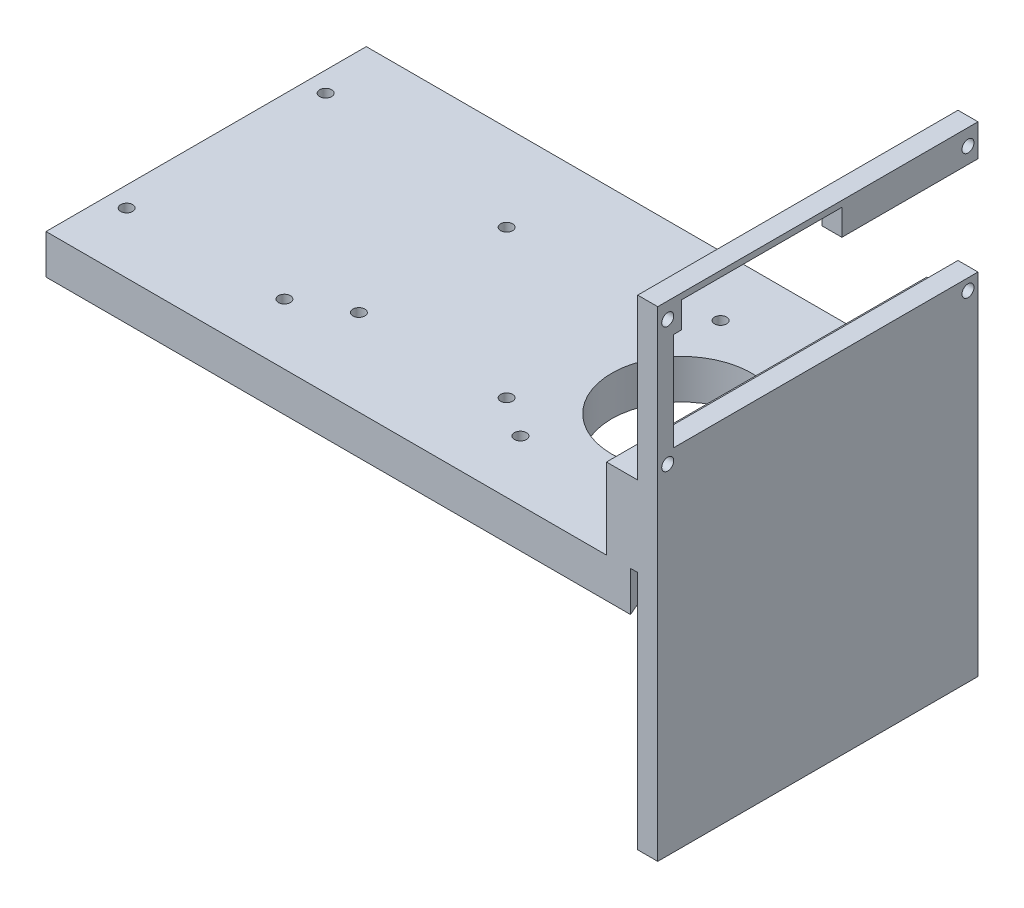
from build123d import *

# Parameters (mm, degrees)
BOSS_EXTRUDE1_DEPTH   = 80
CORTE_EXTRUS_O1_DEPTH = 10
SKETCH3_W             = 5
SKETCH3_H             = 80
BOSS_EXTRUDE2_DEPTH   = 50
SKETCH4_W             = 80
SKETCH4_H             = 9.86245083
BOSS_EXTRUDE3_DEPTH   = 140
SKETCH5_R             = 1.5
SKETCH5_R_2           = 17.5
CUT_EXTRUDE1_DEPTH    = 40
SKETCH6_W             = 5
SKETCH6_H             = 80
BOSS_EXTRUDE4_DEPTH   = 40
SKETCH7_R             = 1.5
CUT_EXTRUDE2_DEPTH    = 40


with BuildPart() as part:
    # Sketch1 → Boss-Extrude1 (new body)
    with BuildSketch(Plane.XY):
        Polygon((0, 0), (0, 30), (12.8, 30), (12.8, 0), (7.8, 0), (7.8, 10), (6, 10), (6, 0), align=None)
    extrude(amount=BOSS_EXTRUDE1_DEPTH)

    # Esboço2 → Corte-extrusão1 (cut)
    with BuildSketch(Plane.XZ):
        with BuildLine():
            Line((6, 80), (6, 0))
            ThreePointArc((6, 0), (-2.670710227, 40), (6, 80))
        make_face()
    extrude(amount=-CORTE_EXTRUS_O1_DEPTH, mode=Mode.SUBTRACT)

    # Sketch3 → Boss-Extrude2 (add)
    with BuildSketch(Plane.XZ):
        with Locations((10.3, 40)):
            Rectangle(SKETCH3_W, SKETCH3_H)
    extrude(amount=BOSS_EXTRUDE2_DEPTH)

    # Sketch4 → Boss-Extrude3 (add)
    with BuildSketch(Plane.ZY):
        with Locations((40, 4.931225415)):
            Rectangle(SKETCH4_W, SKETCH4_H)
    extrude(amount=BOSS_EXTRUDE3_DEPTH)

    # Sketch5 → Cut-Extrude1 (cut)
    with BuildSketch(Plane(origin=(0, 9.86245083, 0), x_dir=(1, 0, 0), z_dir=(0, 1, 0))):
        with Locations(Location((-6.5, -65, 0), (0, 0, 270))):
            Circle(SKETCH5_R)
        with Locations(Location((-36.5, -65, 0), (0, 0, 270))):
            Circle(SKETCH5_R)
        with Locations(Location((-6.5, -15, 0), (0, 0, 270))):
            Circle(SKETCH5_R)
        with Locations(Location((-36.5, -15, 0), (0, 0, 270))):
            Circle(SKETCH5_R)
        with Locations(Location((-21.200454255, -40, 0), (0, 0, 270))):
            Circle(SKETCH5_R_2)
        with Locations(Location((-46.5, -21.55, 0), (0, 0, 270))):
            Circle(SKETCH5_R)
        with Locations(Location((-46.5, -58.45, 0), (0, 0, 270))):
            Circle(SKETCH5_R)
        with Locations(Location((-83.4, -21.55, 0), (0, 0, 270))):
            Circle(SKETCH5_R)
        with Locations(Location((-83.4, -58.45, 0), (0, 0, 270))):
            Circle(SKETCH5_R)
        with Locations(Location((-95.6, -64.85, 0), (0, 0, 270))):
            Circle(SKETCH5_R)
        with Locations(Location((-135, -64.85, 0), (0, 0, 270))):
            Circle(SKETCH5_R)
        with Locations(Location((-135, -15.15, 0), (0, 0, 270))):
            Circle(SKETCH5_R)
    extrude(amount=-CUT_EXTRUDE1_DEPTH, mode=Mode.SUBTRACT)

    # Sketch6 → Boss-Extrude4 (add)
    with BuildSketch(Plane(origin=(0, 30, 0), x_dir=(1, 0, 0), z_dir=(0, 1, 0))):
        with Locations((10.3, -40)):
            Rectangle(SKETCH6_W, SKETCH6_H)
    extrude(amount=BOSS_EXTRUDE4_DEPTH)

    # Sketch7 → Cut-Extrude2 (cut)
    with BuildSketch(Plane(origin=(12.8, 0, 0), x_dir=(0, 0, -1), z_dir=(1, 0, 0))):
        with Locations(Location((-77.5, 66, 0), (0, 0, 90))):
            Circle(SKETCH7_R)
        with Locations(Location((-2.5, 66, 0), (0, 0, 90))):
            Circle(SKETCH7_R)
        with Locations(Location((-2.5, 34.7, 0), (0, 0, 90))):
            Circle(SKETCH7_R)
        with Locations(Location((-77.5, 34.7, 0), (0, 0, 90))):
            Circle(SKETCH7_R)
        Polygon((-74, 68.5), (-74, 62), (-76, 62), (-76, 37.5), (0, 37.5), (0, 62), (-34, 62), (-34, 68.5), align=None)
    extrude(amount=-CUT_EXTRUDE2_DEPTH, mode=Mode.SUBTRACT)


solid = part.part
